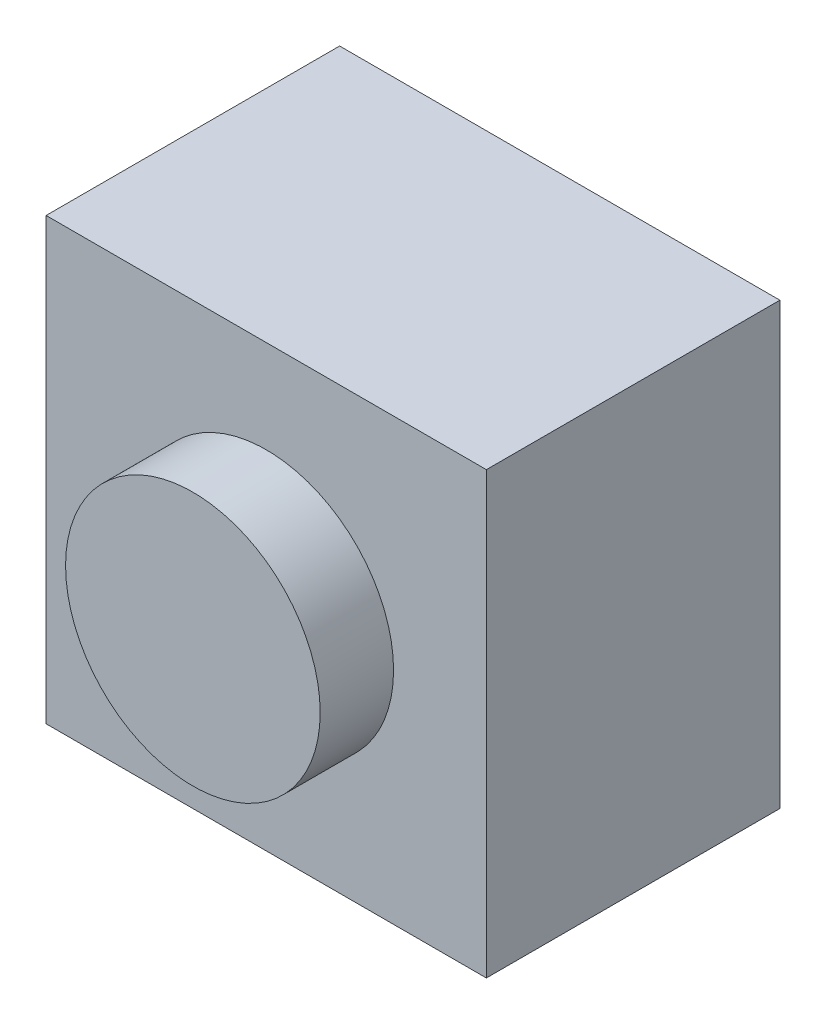
from build123d import *

# Parameters (mm, degrees)
SKETCH2_W           = 6
SKETCH2_H           = 6
BOSS_EXTRUDE1_DEPTH = 4
SKETCH3_R           = 1.735
BOSS_EXTRUDE2_DEPTH = 1


with BuildPart() as part:
    # Sketch2 → Boss-Extrude1 (new body)
    with BuildSketch(Plane.XY):
        Rectangle(SKETCH2_W, SKETCH2_H)
    extrude(amount=BOSS_EXTRUDE1_DEPTH)

    # Sketch3 → Boss-Extrude2 (add)
    with BuildSketch(Plane.XY.offset(4)):
        Circle(SKETCH3_R)
    extrude(amount=BOSS_EXTRUDE2_DEPTH)


solid = part.part
